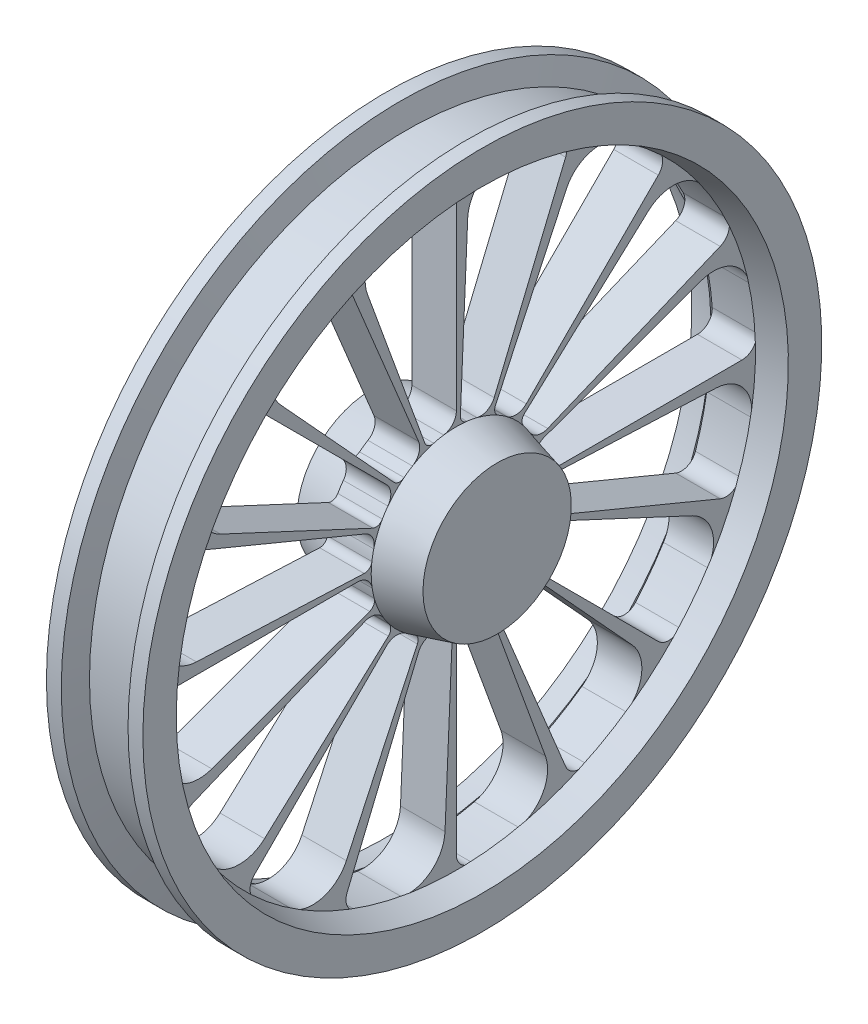
from build123d import *

# Parameters (mm, degrees)
CUT_EXTRUDE1_DEPTH = 60


with BuildPart() as part:
    # Sketch1 → Revolve1 (revolve)
    with BuildSketch(Plane(origin=(0, 0, 0), x_dir=(1, 0, 0), z_dir=(0, 1, 0)), mode=Mode.PRIVATE) as revolve1_sk:
        Polygon((0, 0), (0, 100), (55, 114.737205584), (55, 403.121778265), (20, 412.5), (20, 457.5), (40, 457.5), (48.038475773, 427.5), (121.961524227, 427.5), (130, 457.5), (150, 457.5), (150, 412.5), (115, 403.121778265), (115, 114.737205584), (170, 100), (170, 0), align=None)
    revolve(revolve1_sk.sketch.rotate(Axis((0, 0, 0), (1, 0, 0)), 180), axis=Axis((0, 0, 0), (1, 0, 0)))

    # Sketch2 → Cut-Extrude1 (cut)
    with BuildSketch(Plane.ZY.offset(-55)):
        with BuildLine():
            Line((0, 133.24456675), (0, 384.907314972))
            ThreePointArc((0, 384.907314972), (6.372388685, 399.545901306), (21.428820985, 404.856211448))
            ThreePointArc((21.428820985, 404.856211448), (53.06650756, 401.330060293), (84.327314798, 395.318497707))
            ThreePointArc((84.327314798, 395.318497707), (116.925498089, 370.430350999), (119.938467454, 329.528231053))
            Line((119.938467454, 329.528231053), (42.525319659, 116.837355519))
            ThreePointArc((42.525319659, 116.837355519), (37.714753572, 111.371314729), (30.472538424, 110.616683855))
            ThreePointArc((30.472538424, 110.616683855), (23.794589812, 112.242789705), (17.031258009, 113.46612973))
            ThreePointArc((17.031258009, 113.46612973), (4.844558076, 120.194180546), (0, 133.24456675))
        make_face()
        with BuildLine():
            Line((83.999992685, 91.669906107), (236.913689761, 258.545923656))
            ThreePointArc((236.913689761, 258.545923656), (249.782632686, 297.487568569), (229.190119753, 332.956002585))
            ThreePointArc((229.190119753, 332.956002585), (202.609425181, 350.472955229), (174.729413725, 365.837912601))
            ThreePointArc((174.729413725, 365.837912601), (158.786916378, 366.693672941), (147.297652436, 355.607990217))
            Line((147.297652436, 355.607990217), (50.990488148, 123.101928039))
            ThreePointArc((50.990488148, 123.101928039), (50.472109612, 109.191011221), (59.156438669, 98.311454618))
            ThreePointArc((59.156438669, 98.311454618), (64.936790535, 94.59302078), (70.484126809, 90.535154571))
            ThreePointArc((70.484126809, 90.535154571), (77.463845886, 88.46086684), (83.999992685, 91.669906107))
        make_face()
        with BuildLine():
            Line((112.686428287, 52.54654448), (317.820950431, 148.202343108))
            ThreePointArc((317.820950431, 148.202343108), (344.612625741, 179.255000556), (339.160806589, 219.903974324))
            ThreePointArc((339.160806589, 219.903974324), (321.306894477, 246.259519777), (301.429037151, 271.124107889))
            ThreePointArc((301.429037151, 271.124107889), (287.02757546, 278.015656957), (272.170572545, 272.170572545))
            Line((272.170572545, 272.170572545), (94.218136705, 94.218136705))
            ThreePointArc((94.218136705, 94.218136705), (88.415739991, 81.564500256), (92.275587797, 68.189751737))
            ThreePointArc((92.275587797, 68.189751737), (96.192953552, 62.542321928), (99.765145826, 56.670468707))
            ThreePointArc((99.765145826, 56.670468707), (105.419769876, 52.083053873), (112.686428287, 52.54654448))
        make_face()
        with BuildLine():
            Line((124.217376687, 5.423447792), (350.342852452, 15.296299279))
            ThreePointArc((350.342852452, 15.296299279), (386.978470448, 33.732483659), (397.497335123, 73.373559407))
            ThreePointArc((397.497335123, 73.373559407), (391.088301743, 104.555304787), (382.238822133, 135.134115498))
            ThreePointArc((382.238822133, 135.134115498), (371.57088809, 147.01227742), (355.607990217, 147.297652436))
            Line((355.607990217, 147.297652436), (123.101928039, 50.990488148))
            ThreePointArc((123.101928039, 50.990488148), (112.898875446, 41.520533511), (111.346615163, 27.686777295))
            ThreePointArc((111.346615163, 27.686777295), (112.804611382, 20.970121511), (113.857825765, 14.178217701))
            ThreePointArc((113.857825765, 14.178217701), (117.326489535, 7.776068089), (124.217376687, 5.423447792))
        make_face()
        with BuildLine():
            Line((116.837355519, -42.525319659), (329.528231053, -119.938467454))
            ThreePointArc((329.528231053, -119.938467454), (370.430350999, -116.925498089), (395.318497707, -84.327314798))
            ThreePointArc((395.318497707, -84.327314798), (401.330060293, -53.06650756), (404.856211448, -21.428820985))
            ThreePointArc((404.856211448, -21.428820985), (399.545901306, -6.372388685), (384.907314972, 0))
            Line((384.907314972, 0), (133.24456675, 0))
            ThreePointArc((133.24456675, 0), (120.194180546, -4.844558076), (113.46612973, -17.031258009))
            ThreePointArc((113.46612973, -17.031258009), (112.242789705, -23.794589812), (110.616683855, -30.472538424))
            ThreePointArc((110.616683855, -30.472538424), (111.371314729, -37.714753572), (116.837355519, -42.525319659))
        make_face()
        with BuildLine():
            Line((91.669906107, -83.999992685), (258.545923656, -236.913689761))
            ThreePointArc((258.545923656, -236.913689761), (297.487568569, -249.782632686), (332.956002585, -229.190119753))
            ThreePointArc((332.956002585, -229.190119753), (350.472955229, -202.609425181), (365.837912601, -174.729413725))
            ThreePointArc((365.837912601, -174.729413725), (366.693672941, -158.786916378), (355.607990217, -147.297652436))
            Line((355.607990217, -147.297652436), (123.101928039, -50.990488148))
            ThreePointArc((123.101928039, -50.990488148), (109.191011221, -50.472109612), (98.311454618, -59.156438669))
            ThreePointArc((98.311454618, -59.156438669), (94.59302078, -64.936790535), (90.535154571, -70.484126809))
            ThreePointArc((90.535154571, -70.484126809), (88.46086684, -77.463845886), (91.669906107, -83.999992685))
        make_face()
        with BuildLine():
            Line((52.54654448, -112.686428287), (148.202343108, -317.820950431))
            ThreePointArc((148.202343108, -317.820950431), (179.255000556, -344.612625741), (219.903974324, -339.160806589))
            ThreePointArc((219.903974324, -339.160806589), (246.259519777, -321.306894477), (271.124107889, -301.429037151))
            ThreePointArc((271.124107889, -301.429037151), (278.015656957, -287.02757546), (272.170572545, -272.170572545))
            Line((272.170572545, -272.170572545), (94.218136705, -94.218136705))
            ThreePointArc((94.218136705, -94.218136705), (81.564500256, -88.415739991), (68.189751737, -92.275587797))
            ThreePointArc((68.189751737, -92.275587797), (62.542321928, -96.192953552), (56.670468707, -99.765145826))
            ThreePointArc((56.670468707, -99.765145826), (52.083053873, -105.419769876), (52.54654448, -112.686428287))
        make_face()
        with BuildLine():
            Line((5.423447792, -124.217376687), (15.296299279, -350.342852452))
            ThreePointArc((15.296299279, -350.342852452), (33.732483659, -386.978470448), (73.373559407, -397.497335123))
            ThreePointArc((73.373559407, -397.497335123), (104.555304787, -391.088301743), (135.134115498, -382.238822133))
            ThreePointArc((135.134115498, -382.238822133), (147.01227742, -371.57088809), (147.297652436, -355.607990217))
            Line((147.297652436, -355.607990217), (50.990488148, -123.101928039))
            ThreePointArc((50.990488148, -123.101928039), (41.520533511, -112.898875446), (27.686777295, -111.346615163))
            ThreePointArc((27.686777295, -111.346615163), (20.970121511, -112.804611382), (14.178217701, -113.857825765))
            ThreePointArc((14.178217701, -113.857825765), (7.776068089, -117.326489535), (5.423447792, -124.217376687))
        make_face()
        with BuildLine():
            Line((-42.525319659, -116.837355519), (-119.938467454, -329.528231053))
            ThreePointArc((-119.938467454, -329.528231053), (-116.925498089, -370.430350999), (-84.327314798, -395.318497707))
            ThreePointArc((-84.327314798, -395.318497707), (-53.06650756, -401.330060293), (-21.428820985, -404.856211448))
            ThreePointArc((-21.428820985, -404.856211448), (-6.372388685, -399.545901306), (0, -384.907314972))
            Line((0, -384.907314972), (0, -133.24456675))
            ThreePointArc((0, -133.24456675), (-4.844558076, -120.194180546), (-17.031258009, -113.46612973))
            ThreePointArc((-17.031258009, -113.46612973), (-23.794589812, -112.242789705), (-30.472538424, -110.616683855))
            ThreePointArc((-30.472538424, -110.616683855), (-37.714753572, -111.371314729), (-42.525319659, -116.837355519))
        make_face()
        with BuildLine():
            Line((-83.999992685, -91.669906107), (-236.913689761, -258.545923656))
            ThreePointArc((-236.913689761, -258.545923656), (-249.782632686, -297.487568569), (-229.190119753, -332.956002585))
            ThreePointArc((-229.190119753, -332.956002585), (-202.609425181, -350.472955229), (-174.729413725, -365.837912601))
            ThreePointArc((-174.729413725, -365.837912601), (-158.786916378, -366.693672941), (-147.297652436, -355.607990217))
            Line((-147.297652436, -355.607990217), (-50.990488148, -123.101928039))
            ThreePointArc((-50.990488148, -123.101928039), (-50.472109612, -109.191011221), (-59.156438669, -98.311454618))
            ThreePointArc((-59.156438669, -98.311454618), (-64.936790535, -94.59302078), (-70.484126809, -90.535154571))
            ThreePointArc((-70.484126809, -90.535154571), (-77.463845886, -88.46086684), (-83.999992685, -91.669906107))
        make_face()
        with BuildLine():
            Line((-112.686428287, -52.54654448), (-317.820950431, -148.202343108))
            ThreePointArc((-317.820950431, -148.202343108), (-344.612625741, -179.255000556), (-339.160806589, -219.903974324))
            ThreePointArc((-339.160806589, -219.903974324), (-321.306894477, -246.259519777), (-301.429037151, -271.124107889))
            ThreePointArc((-301.429037151, -271.124107889), (-287.02757546, -278.015656957), (-272.170572545, -272.170572545))
            Line((-272.170572545, -272.170572545), (-94.218136705, -94.218136705))
            ThreePointArc((-94.218136705, -94.218136705), (-88.415739991, -81.564500256), (-92.275587797, -68.189751737))
            ThreePointArc((-92.275587797, -68.189751737), (-96.192953552, -62.542321928), (-99.765145826, -56.670468707))
            ThreePointArc((-99.765145826, -56.670468707), (-105.419769876, -52.083053873), (-112.686428287, -52.54654448))
        make_face()
        with BuildLine():
            Line((-124.217376687, -5.423447792), (-350.342852452, -15.296299279))
            ThreePointArc((-350.342852452, -15.296299279), (-386.978470448, -33.732483659), (-397.497335123, -73.373559407))
            ThreePointArc((-397.497335123, -73.373559407), (-391.088301743, -104.555304787), (-382.238822133, -135.134115498))
            ThreePointArc((-382.238822133, -135.134115498), (-371.57088809, -147.01227742), (-355.607990217, -147.297652436))
            Line((-355.607990217, -147.297652436), (-123.101928039, -50.990488148))
            ThreePointArc((-123.101928039, -50.990488148), (-112.898875446, -41.520533511), (-111.346615163, -27.686777295))
            ThreePointArc((-111.346615163, -27.686777295), (-112.804611382, -20.970121511), (-113.857825765, -14.178217701))
            ThreePointArc((-113.857825765, -14.178217701), (-117.326489535, -7.776068089), (-124.217376687, -5.423447792))
        make_face()
        with BuildLine():
            Line((-116.837355519, 42.525319659), (-329.528231053, 119.938467454))
            ThreePointArc((-329.528231053, 119.938467454), (-370.430350999, 116.925498089), (-395.318497707, 84.327314798))
            ThreePointArc((-395.318497707, 84.327314798), (-401.330060293, 53.06650756), (-404.856211448, 21.428820985))
            ThreePointArc((-404.856211448, 21.428820985), (-399.545901306, 6.372388685), (-384.907314972, 0))
            Line((-384.907314972, 0), (-133.24456675, 0))
            ThreePointArc((-133.24456675, 0), (-120.194180546, 4.844558076), (-113.46612973, 17.031258009))
            ThreePointArc((-113.46612973, 17.031258009), (-112.242789705, 23.794589812), (-110.616683855, 30.472538424))
            ThreePointArc((-110.616683855, 30.472538424), (-111.371314729, 37.714753572), (-116.837355519, 42.525319659))
        make_face()
        with BuildLine():
            Line((-91.669906107, 83.999992685), (-258.545923656, 236.913689761))
            ThreePointArc((-258.545923656, 236.913689761), (-297.487568569, 249.782632686), (-332.956002585, 229.190119753))
            ThreePointArc((-332.956002585, 229.190119753), (-350.472955229, 202.609425181), (-365.837912601, 174.729413725))
            ThreePointArc((-365.837912601, 174.729413725), (-366.693672941, 158.786916378), (-355.607990217, 147.297652436))
            Line((-355.607990217, 147.297652436), (-123.101928039, 50.990488148))
            ThreePointArc((-123.101928039, 50.990488148), (-109.191011221, 50.472109612), (-98.311454618, 59.156438669))
            ThreePointArc((-98.311454618, 59.156438669), (-94.59302078, 64.936790535), (-90.535154571, 70.484126809))
            ThreePointArc((-90.535154571, 70.484126809), (-88.46086684, 77.463845886), (-91.669906107, 83.999992685))
        make_face()
        with BuildLine():
            Line((-52.54654448, 112.686428287), (-148.202343108, 317.820950431))
            ThreePointArc((-148.202343108, 317.820950431), (-179.255000556, 344.612625741), (-219.903974324, 339.160806589))
            ThreePointArc((-219.903974324, 339.160806589), (-246.259519777, 321.306894477), (-271.124107889, 301.429037151))
            ThreePointArc((-271.124107889, 301.429037151), (-278.015656957, 287.02757546), (-272.170572545, 272.170572545))
            Line((-272.170572545, 272.170572545), (-94.218136705, 94.218136705))
            ThreePointArc((-94.218136705, 94.218136705), (-81.564500256, 88.415739991), (-68.189751737, 92.275587797))
            ThreePointArc((-68.189751737, 92.275587797), (-62.542321928, 96.192953552), (-56.670468707, 99.765145826))
            ThreePointArc((-56.670468707, 99.765145826), (-52.083053873, 105.419769876), (-52.54654448, 112.686428287))
        make_face()
        with BuildLine():
            Line((-5.423447792, 124.217376687), (-15.296299279, 350.342852452))
            ThreePointArc((-15.296299279, 350.342852452), (-33.732483659, 386.978470448), (-73.373559407, 397.497335123))
            ThreePointArc((-73.373559407, 397.497335123), (-104.555304787, 391.088301743), (-135.134115498, 382.238822133))
            ThreePointArc((-135.134115498, 382.238822133), (-147.01227742, 371.57088809), (-147.297652436, 355.607990217))
            Line((-147.297652436, 355.607990217), (-50.990488148, 123.101928039))
            ThreePointArc((-50.990488148, 123.101928039), (-41.520533511, 112.898875446), (-27.686777295, 111.346615163))
            ThreePointArc((-27.686777295, 111.346615163), (-20.970121511, 112.804611382), (-14.178217701, 113.857825765))
            ThreePointArc((-14.178217701, 113.857825765), (-7.776068089, 117.326489535), (-5.423447792, 124.217376687))
        make_face()
    extrude(amount=-CUT_EXTRUDE1_DEPTH, mode=Mode.SUBTRACT)


solid = part.part
